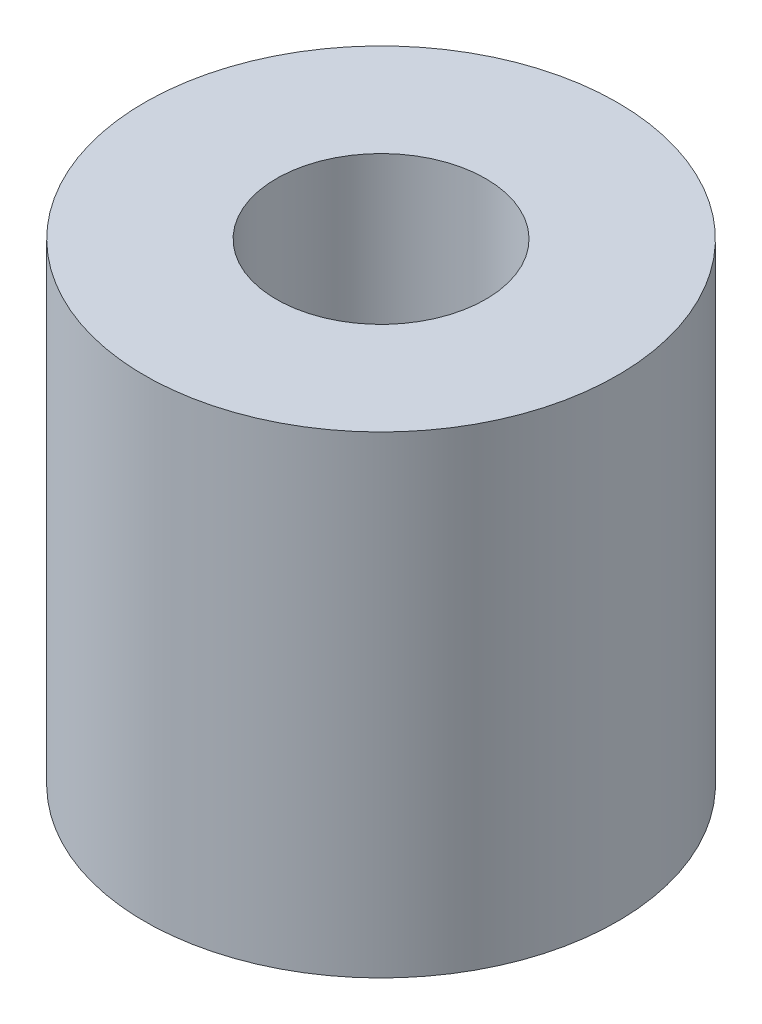
from build123d import *

# Parameters (mm, degrees)
SKETCH1_R           = 4.7625
SKETCH1_R_2         = 2.1082
BOSS_EXTRUDE1_DEPTH = 9.525


with BuildPart() as part:
    # Sketch1 → Boss-Extrude1 (new body)
    with BuildSketch(Plane(origin=(0, 0, 0), x_dir=(1, 0, 0), z_dir=(0, 1, 0))):
        with Locations(Location((0, 0, 0), (0, 0, 90))):
            Circle(SKETCH1_R)
        with Locations(Location((0, 0, 0), (0, 0, 90))):
            Circle(SKETCH1_R_2, mode=Mode.SUBTRACT)
    extrude(amount=BOSS_EXTRUDE1_DEPTH)


solid = part.part
